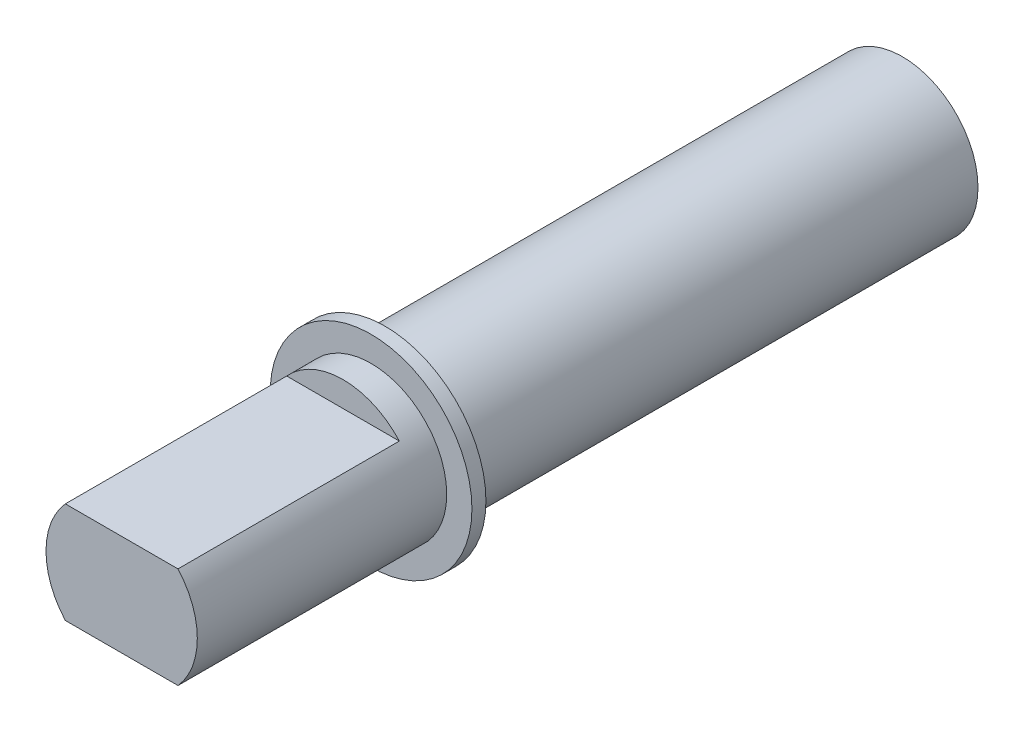
from build123d import *

# Parameters (mm, degrees)
SKETCH1_R           = 2.7
BOSS_EXTRUDE1_DEPTH = 9.23
SKETCH2_R           = 3.6
BOSS_EXTRUDE2_DEPTH = 0.5
BOSS_EXTRUDE3_START = 1
SKETCH3_R           = 2.7
BOSS_EXTRUDE3_DEPTH = 1
BOSS_EXTRUDE4_START = 8.9
BOSS_EXTRUDE4_DEPTH = 8.9


with BuildPart() as part:
    # Sketch1 → Boss-Extrude1 (new, symmetric)
    with BuildSketch(Plane.XY):
        Circle(SKETCH1_R)
    extrude(amount=BOSS_EXTRUDE1_DEPTH, both=True)

    # Sketch2 → Boss-Extrude2 (add)
    with BuildSketch(Plane.XY.offset(9.23)):
        Circle(SKETCH2_R)
    extrude(amount=BOSS_EXTRUDE2_DEPTH)

    # Sketch3 → Boss-Extrude3 (add)
    with BuildSketch(Plane.XY.offset(9.73).offset(BOSS_EXTRUDE3_START)):
        Circle(SKETCH3_R)
    extrude(amount=-BOSS_EXTRUDE3_DEPTH)

    # Sketch3<3> → Boss-Extrude4 (add)
    with BuildSketch(Plane.XY.offset(9.73).offset(BOSS_EXTRUDE4_START)):
        with BuildLine():
            ThreePointArc((-2.01, 1.802747903), (-2.7, 0), (-2.01, -1.802747903))
            Line((-2.01, -1.802747903), (2.01, -1.802747903))
            ThreePointArc((2.01, -1.802747903), (2.7, 0), (2.01, 1.802747903))
            Line((2.01, 1.802747903), (-2.01, 1.802747903))
        make_face()
    extrude(amount=-BOSS_EXTRUDE4_DEPTH)


solid = part.part
